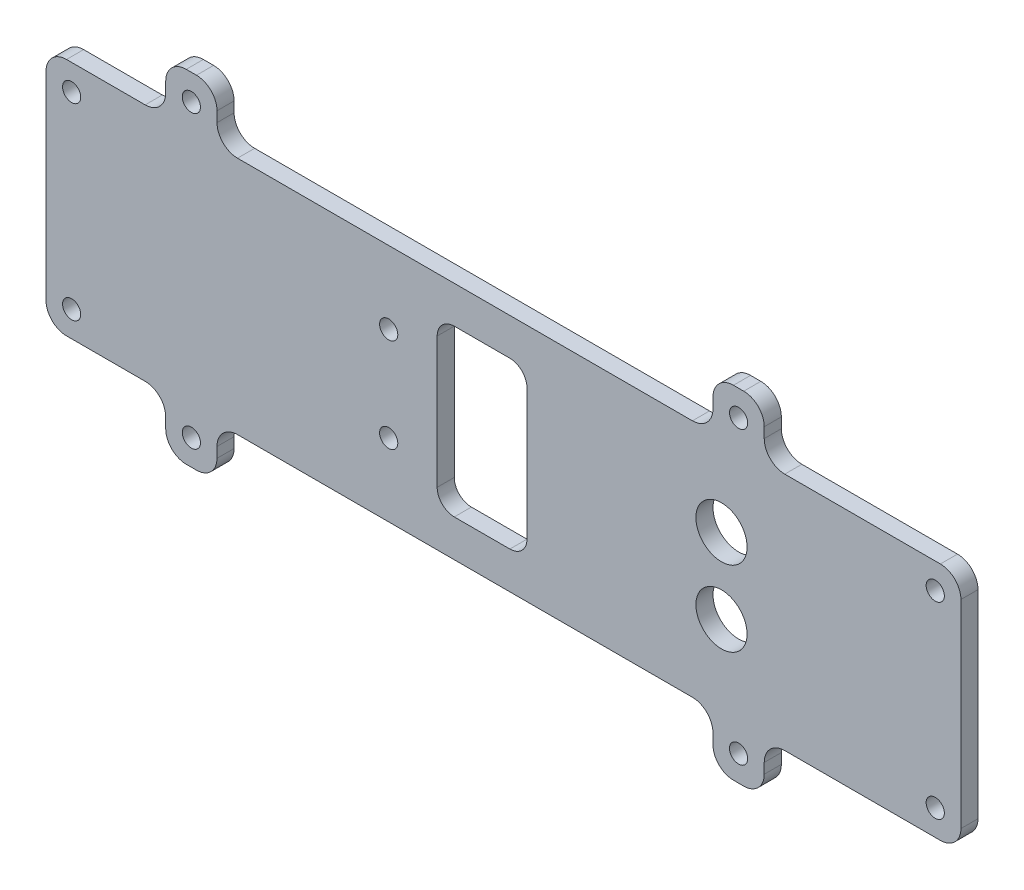
from build123d import *

# Parameters (mm, degrees)
SKETCH1_W               = 254
SKETCH1_H               = 88.9
SKETCH1_R               = 9.5
SKETCH1_W_2             = 27
SKETCH1_H_2             = 55
BOSS_EXTRUDE1_DEPTH     = 6.35
SKETCH4_W               = 19.05
SKETCH4_H               = 19.05
BOSS_EXTRUDE2_DEPTH     = 6.35
SKETCH7_W               = 34.925
SKETCH7_H               = 88.9
SKETCH7_W_2             = 50.8
BOSS_EXTRUDE3_DEPTH     = 6.35
F_1_4_CLEARANCE_HOLE1_D = 6.7564
FILLET1_R               = 3.175
FILLET2_R               = 7.62
CUT_EXTRUDE1_DEPTH      = 189.905829714


with BuildPart() as part:
    # Sketch1 → Boss-Extrude1 (new body)
    with BuildSketch(Plane(origin=(0, 0, 0), x_dir=(-1, 0, 0), z_dir=(0, 0, -1))):
        Rectangle(SKETCH1_W, SKETCH1_H)
        with Locations(Location((-88.9000016, 14, 0), (0, 0, 180))):
            Circle(SKETCH1_R, mode=Mode.SUBTRACT)
        with Locations(Location((-88.9000016, -14, 0), (0, 0, 180))):
            Circle(SKETCH1_R, mode=Mode.SUBTRACT)
        Rectangle(SKETCH1_W_2, SKETCH1_H_2, mode=Mode.SUBTRACT)
    extrude(amount=-BOSS_EXTRUDE1_DEPTH)

    # Sketch4 → Boss-Extrude2 (add)
    with BuildSketch(Plane.XY.offset(6.35)):
        with Locations((-107.95, 53.975)):
            Rectangle(SKETCH4_W, SKETCH4_H)
        with Locations((-107.95, -53.975)):
            Rectangle(SKETCH4_W, SKETCH4_H)
        with Locations((95.25, -53.975)):
            Rectangle(SKETCH4_W, SKETCH4_H)
        with Locations((95.25, 53.975)):
            Rectangle(SKETCH4_W, SKETCH4_H)
    extrude(amount=-BOSS_EXTRUDE2_DEPTH)

    # Sketch7 → Boss-Extrude3 (add)
    with BuildSketch(Plane.XY.offset(6.35)):
        with Locations((-144.4625, 0)):
            Rectangle(SKETCH7_W, SKETCH7_H)
        with Locations((152.4, 0)):
            Rectangle(SKETCH7_W_2, SKETCH7_H)
    extrude(amount=-BOSS_EXTRUDE3_DEPTH)

    # 1/4 Clearance Hole1 (through all)
    with Locations(Plane.XY.offset(6.35)):
        with Locations((-107.95, 53.975), (95.25, 53.975), (95.25, -53.975), (-107.95, -53.975), (168.275, -34.925), (168.275, 34.925), (-152.4, 34.925), (-152.4, -34.925), (-34.675, 17.4625), (-34.675, -17.4625)):
            Hole(F_1_4_CLEARANCE_HOLE1_D / 2)

    # Fillet1
    fillet1_edges = [part.edges().sort_by_distance(p)[0] for p in [
        (13.5, 27.5, 3.175),
        (-13.5, 27.5, 3.175),
        (-13.5, -27.5, 3.175),
        (13.5, -27.5, 3.175),
    ]]
    fillet(fillet1_edges, radius=FILLET1_R)

    # Fillet2
    fillet2_edges = [part.edges().sort_by_distance(p)[0] for p in [
        (-98.425, 44.45, 3.175),
        (-98.425, 63.5, 3.175),
        (-117.475, 63.5, 3.175),
        (-117.475, 44.45, 3.175),
        (-98.425, -63.5, 3.175),
        (-98.425, -44.45, 3.175),
        (-117.475, -44.45, 3.175),
        (-117.475, -63.5, 3.175),
        (85.725, -63.5, 3.175),
        (104.775, -63.5, 3.175),
        (104.775, -44.45, 3.175),
        (85.725, -44.45, 3.175),
        (85.725, 63.5, 3.175),
        (85.725, 44.45, 3.175),
        (104.775, 44.45, 3.175),
        (104.775, 63.5, 3.175),
        (-161.925, 44.45, 3.175),
        (-161.925, -44.45, 3.175),
        (177.8, -44.45, 3.175),
        (177.8, 44.45, 3.175),
    ]]
    fillet(fillet2_edges, radius=FILLET2_R)

    # Sketch8 → Cut-Extrude1 (cut, through all)
    with BuildSketch(Plane(origin=(0, 0, 0), x_dir=(-1, 0, 0), z_dir=(0, 0, -1))):
        with BuildLine():
            Line((10.325, 30.675), (-10.325, 30.675))
            ThreePointArc((-10.325, 30.675), (-14.815128061, 28.815128061), (-16.675, 24.325))
            Line((-16.675, 24.325), (-16.675, -24.325))
            ThreePointArc((-16.675, -24.325), (-14.815128061, -28.815128061), (-10.325, -30.675))
            Line((-10.325, -30.675), (10.325, -30.675))
            ThreePointArc((10.325, -30.675), (14.815128061, -28.815128061), (16.675, -24.325))
            Line((16.675, -24.325), (16.675, 24.325))
            ThreePointArc((16.675, 24.325), (14.815128061, 28.815128061), (10.325, 30.675))
        make_face()
        with BuildLine():
            Line((10.325, 27.5), (-10.325, 27.5))
            ThreePointArc((-10.325, 27.5), (-12.57006403, 26.57006403), (-13.5, 24.325))
            Line((-13.5, 24.325), (-13.5, -24.325))
            ThreePointArc((-13.5, -24.325), (-12.57006403, -26.57006403), (-10.325, -27.5))
            Line((-10.325, -27.5), (10.325, -27.5))
            ThreePointArc((10.325, -27.5), (12.57006403, -26.57006403), (13.5, -24.325))
            Line((13.5, -24.325), (13.5, 24.325))
            ThreePointArc((13.5, 24.325), (12.57006403, 26.57006403), (10.325, 27.5))
        make_face(mode=Mode.SUBTRACT)
    extrude(amount=-CUT_EXTRUDE1_DEPTH, mode=Mode.SUBTRACT)


solid = part.part
